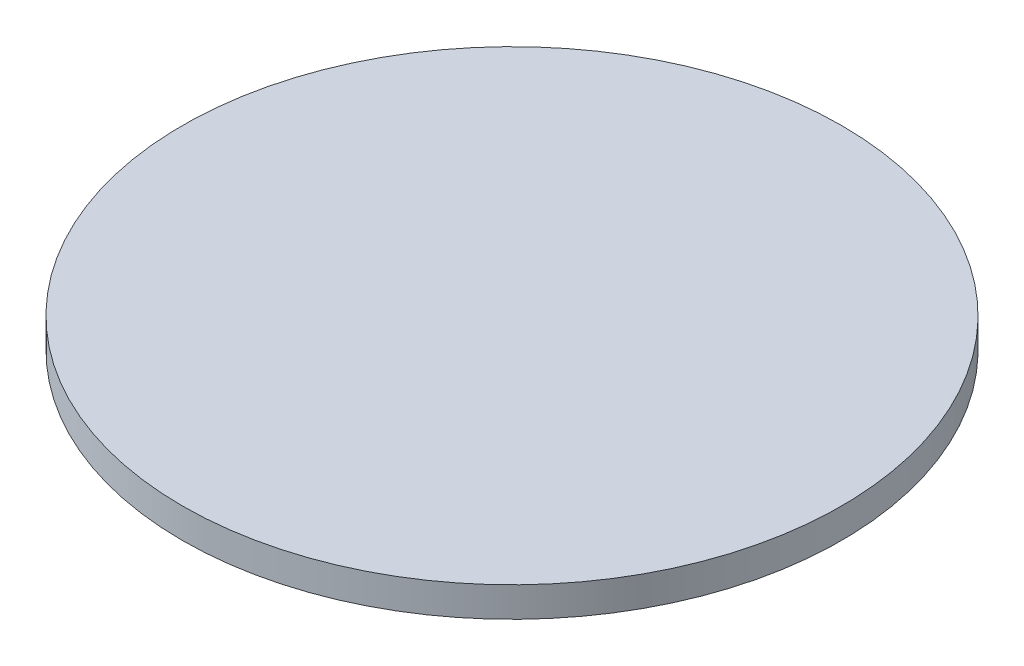
from build123d import *

# Parameters (mm, degrees)
SKETCH1_R = 2.936875
CAP_DEPTH = 0.26662507


with BuildPart() as part:
    # Sketch1 → cap (new body)
    with BuildSketch(Plane(origin=(0, 0, 0), x_dir=(1, 0, 0), z_dir=(0, 1, 0))):
        with Locations(Location((0, 0, 0), (0, 0, 270))):
            Circle(SKETCH1_R)
    extrude(amount=CAP_DEPTH)


solid = part.part
